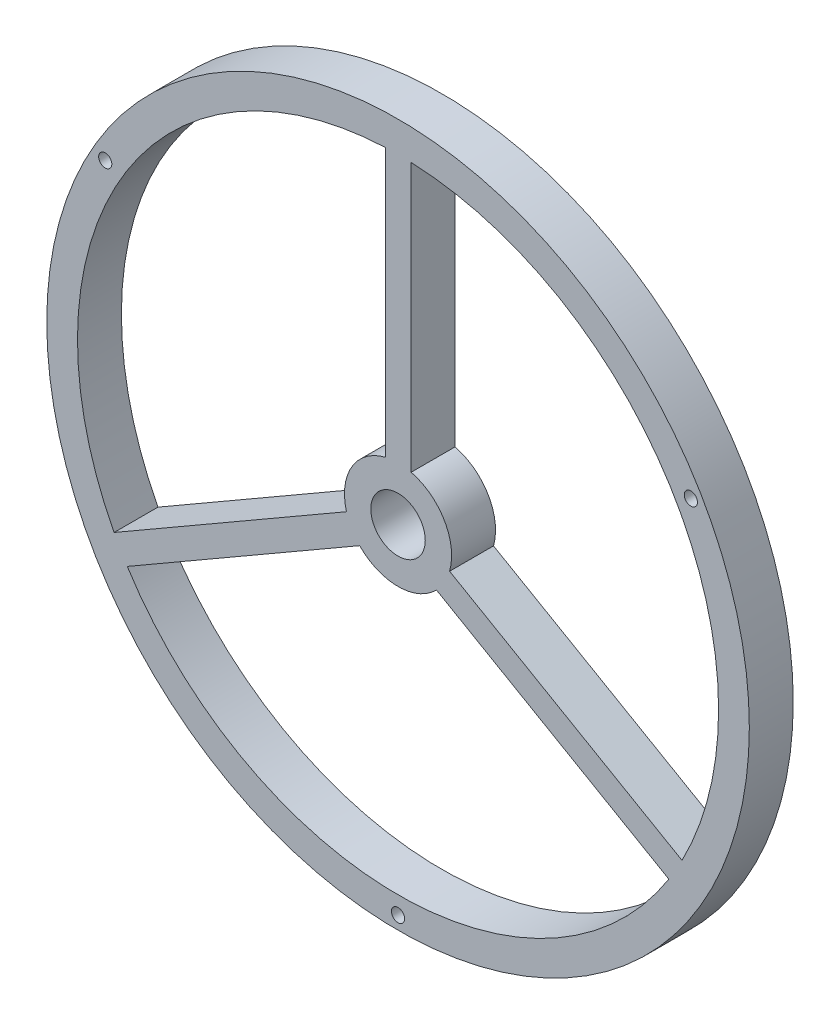
from build123d import *

# Parameters (mm, degrees)
SKETCH_1_R          = 40
SKETCH_1_R_2        = 3.1
EXTRUDE_2_DEPTH     = 5
SKETCH_2_R          = 0.75
CUT_EXTRUDE_1_DEPTH = 5


with BuildPart() as part:
    # 草图1 → 凸台-拉伸2 (new body)
    # profile 1 of 11: a face of its own
    with BuildSketch(Plane.XY):
        with Locations((48.296474355, 27.924907455)):
            Circle(SKETCH_1_R)
        with BuildLine():
            Line((81.82316003, 10.300317263), (81.07316003, 9.001279158))
            Line((81.07316003, 9.001279158), (80.32316003, 7.702241052))
            Line((80.32316003, 7.702241052), (79.12969775, 8.391286821))
            ThreePointArc((79.12969775, 8.391286821), (48.296474355, -8.575092545), (17.46325096, 8.391286821))
            Line((17.46325096, 8.391286821), (16.26978868, 7.702241052))
            Line((16.26978868, 7.702241052), (15.51978868, 9.001279158))
            Line((15.51978868, 9.001279158), (14.76978868, 10.300317263))
            Line((14.76978868, 10.300317263), (15.96325096, 10.989363032))
            ThreePointArc((15.96325096, 10.989363032), (16.69953266, 46.197380619), (46.84834221, 64.396168926))
            Line((46.84834221, 64.396168926), (46.84834221, 66.091480515))
            Line((46.84834221, 66.091480515), (49.787930978, 66.091480515))
            Line((49.787930978, 66.091480515), (49.787930978, 64.394422905))
            ThreePointArc((49.787930978, 64.394422905), (74.627902029, 53.201495766), (84.796474355, 27.924907455))
            ThreePointArc((84.796474355, 27.924907455), (83.739475455, 19.204605107), (80.62969775, 10.989363032))
            Line((80.62969775, 10.989363032), (81.82316003, 10.300317263))
        make_face(mode=Mode.SUBTRACT)
    # profile 2 of 11: a face of its own
    with BuildSketch(Plane.XY):
        with BuildLine():
            Line((52.565394479, 27.19229608), (54.167021201, 26.267596461))
            ThreePointArc((54.167021201, 26.267596461), (54.338838783, 27.088347762), (54.396474355, 27.924907455))
            ThreePointArc((54.396474355, 27.924907455), (53.108328748, 31.67404833), (49.787930978, 33.839766468))
            Line((49.787930978, 33.839766468), (49.787930978, 32.638782116))
            Line((49.787930978, 32.638782116), (46.84834221, 32.638782116))
            Line((46.84834221, 32.638782116), (46.84834221, 33.850522469))
            ThreePointArc((46.84834221, 33.850522469), (43.027133101, 30.998023585), (42.425927509, 26.267596461))
            Line((42.425927509, 26.267596461), (43.927397053, 27.134470306))
            Line((43.927397053, 27.134470306), (45.427397053, 24.536394095))
            Line((45.427397053, 24.536394095), (43.925927509, 23.66952025))
            ThreePointArc((43.925927509, 23.66952025), (48.296474355, 21.824907455), (52.667021201, 23.66952025))
            Line((52.667021201, 23.66952025), (51.065394479, 24.594219869))
            Line((51.065394479, 24.594219869), (52.565394479, 27.19229608))
        make_face()
        with Locations((48.296474355, 27.924907455)):
            Circle(SKETCH_1_R_2, mode=Mode.SUBTRACT)
    # profile 3 of 11: a face of its own
    with BuildSketch(Plane.XY):
        with BuildLine():
            ThreePointArc((15.96325096, 10.989363032), (16.686547117, 9.674907455), (17.46325096, 8.391286821))
            Line((17.46325096, 8.391286821), (43.925927509, 23.66952025))
            ThreePointArc((43.925927509, 23.66952025), (43.013719392, 24.874907455), (42.425927509, 26.267596461))
            Line((42.425927509, 26.267596461), (15.96325096, 10.989363032))
        make_face()
    # profile 4 of 11: a face of its own
    with BuildSketch(Plane.XY):
        with BuildLine():
            Line((16.26978868, 7.702241052), (17.46325096, 8.391286821))
            ThreePointArc((17.46325096, 8.391286821), (16.686547117, 9.674907455), (15.96325096, 10.989363032))
            Line((15.96325096, 10.989363032), (14.76978868, 10.300317263))
            Line((14.76978868, 10.300317263), (15.51978868, 9.001279158))
            Line((15.51978868, 9.001279158), (16.26978868, 7.702241052))
        make_face()
    # profile 5 of 11: a face of its own
    with BuildSketch(Plane.XY):
        with BuildLine():
            ThreePointArc((52.667021201, 23.66952025), (53.579229318, 24.874907455), (54.167021201, 26.267596461))
            Line((54.167021201, 26.267596461), (52.565394479, 27.19229608))
            Line((52.565394479, 27.19229608), (51.065394479, 24.594219869))
            Line((51.065394479, 24.594219869), (52.667021201, 23.66952025))
        make_face()
    # profile 6 of 11: a face of its own
    with BuildSketch(Plane.XY):
        with BuildLine():
            Line((49.787930978, 32.638782116), (49.787930978, 33.839766468))
            ThreePointArc((49.787930978, 33.839766468), (48.3187942, 34.024866621), (46.84834221, 33.850522469))
            Line((46.84834221, 33.850522469), (46.84834221, 32.638782116))
            Line((46.84834221, 32.638782116), (49.787930978, 32.638782116))
        make_face()
    # profile 7 of 11: a face of its own
    with BuildSketch(Plane.XY):
        with BuildLine():
            ThreePointArc((42.425927509, 26.267596461), (43.013719392, 24.874907455), (43.925927509, 23.66952025))
            Line((43.925927509, 23.66952025), (45.427397053, 24.536394095))
            Line((45.427397053, 24.536394095), (43.927397053, 27.134470306))
            Line((43.927397053, 27.134470306), (42.425927509, 26.267596461))
        make_face()
    # profile 8 of 11: a face of its own
    with BuildSketch(Plane.XY):
        with BuildLine():
            Line((49.787930978, 33.839766468), (49.787930978, 64.394422905))
            ThreePointArc((49.787930978, 64.394422905), (48.318154178, 64.424901017), (46.84834221, 64.396168926))
            Line((46.84834221, 64.396168926), (46.84834221, 33.850522469))
            ThreePointArc((46.84834221, 33.850522469), (48.3187942, 34.024866621), (49.787930978, 33.839766468))
        make_face()
    # profile 9 of 11: a face of its own
    with BuildSketch(Plane.XY):
        with BuildLine():
            ThreePointArc((46.84834221, 64.396168926), (48.318154178, 64.424901017), (49.787930978, 64.394422905))
            Line((49.787930978, 64.394422905), (49.787930978, 66.091480515))
            Line((49.787930978, 66.091480515), (46.84834221, 66.091480515))
            Line((46.84834221, 66.091480515), (46.84834221, 64.396168926))
        make_face()
    # profile 10 of 11: a face of its own
    with BuildSketch(Plane.XY):
        with BuildLine():
            Line((80.32316003, 7.702241052), (81.07316003, 9.001279158))
            Line((81.07316003, 9.001279158), (81.82316003, 10.300317263))
            Line((81.82316003, 10.300317263), (80.62969775, 10.989363032))
            ThreePointArc((80.62969775, 10.989363032), (79.906401593, 9.674907455), (79.12969775, 8.391286821))
            Line((79.12969775, 8.391286821), (80.32316003, 7.702241052))
        make_face()
    # profile 11 of 11: a face of its own
    with BuildSketch(Plane.XY):
        with BuildLine():
            ThreePointArc((79.12969775, 8.391286821), (79.906401593, 9.674907455), (80.62969775, 10.989363032))
            Line((80.62969775, 10.989363032), (54.167021201, 26.267596461))
            ThreePointArc((54.167021201, 26.267596461), (53.579229318, 24.874907455), (52.667021201, 23.66952025))
            Line((52.667021201, 23.66952025), (79.12969775, 8.391286821))
        make_face()
    extrude(amount=EXTRUDE_2_DEPTH)

    # 草图2 → 切除-拉伸1 (cut)
    with BuildSketch(Plane.XY.offset(5)):
        with Locations((14.954496309, 47.174907455)):
            Circle(SKETCH_2_R)
        with Locations((81.638452401, 47.174907455)):
            Circle(SKETCH_2_R)
        with Locations((48.296474355, -10.575092545)):
            Circle(SKETCH_2_R)
    extrude(amount=-CUT_EXTRUDE_1_DEPTH, mode=Mode.SUBTRACT)


solid = part.part
